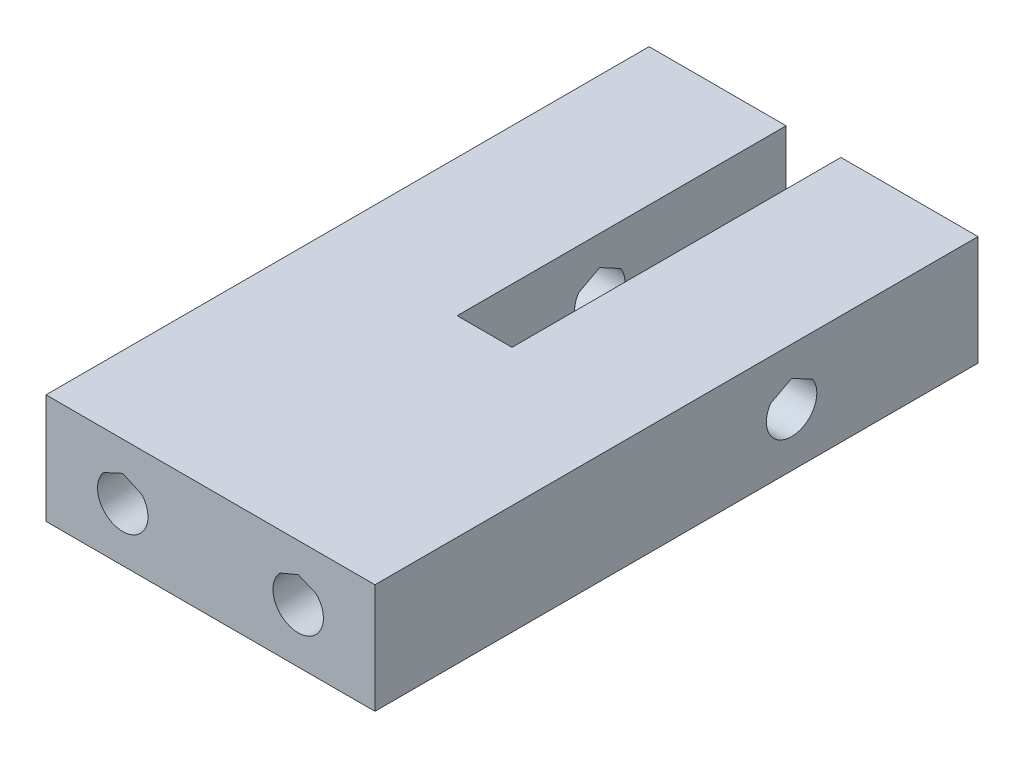
from build123d import *

# Parameters (mm, degrees)
SKETCH1_W           = 30
SKETCH1_H           = 55
BOSS_EXTRUDE1_DEPTH = 10
CUT_EXTRUDE1_DEPTH  = 58.879184514
CUT_EXTRUDE3_DEPTH  = 42.907636536
SKETCH9_W           = 5
SKETCH9_H           = 30
CUT_EXTRUDE4_DEPTH  = 10


with BuildPart() as part:
    # Sketch1 → Boss-Extrude1 (new body)
    with BuildSketch(Plane(origin=(0, 0, 0), x_dir=(1, 0, 0), z_dir=(0, 1, 0))):
        Rectangle(SKETCH1_W, SKETCH1_H)
    extrude(amount=BOSS_EXTRUDE1_DEPTH)

    # Sketch6 → Cut-Extrude1 (cut, through all)
    with BuildSketch(Plane(origin=(0, 0, -27.5), x_dir=(-1, 0, 0), z_dir=(0, 0, -1))):
        with BuildLine():
            Line((-8, 7.3), (-9.647377045, 6.605038589))
            ThreePointArc((-9.647377045, 6.605038589), (-8, 2.7), (-6.352622955, 6.605038589))
            Line((-6.352622955, 6.605038589), (-8, 7.3))
        make_face()
        with BuildLine():
            Line((8, 7.3), (6.243284106, 6.484570399))
            ThreePointArc((6.243284106, 6.484570399), (8, 2.7), (9.756715894, 6.484570399))
            Line((9.756715894, 6.484570399), (8, 7.3))
        make_face()
    extrude(amount=-CUT_EXTRUDE1_DEPTH, mode=Mode.SUBTRACT)

    # Sketch8 → Cut-Extrude3 (cut, through all)
    with BuildSketch(Plane(origin=(15, 0, 0), x_dir=(0, 0, -1), z_dir=(1, 0, 0))):
        with BuildLine():
            Line((10.5, 7.3), (12.417920009, 6.269481327))
            ThreePointArc((12.417920009, 6.269481327), (10.5, 2.7), (8.582079991, 6.269481327))
            Line((8.582079991, 6.269481327), (10.5, 7.3))
        make_face()
    extrude(amount=-CUT_EXTRUDE3_DEPTH, mode=Mode.SUBTRACT)

    # Sketch9 → Cut-Extrude4 (cut)
    with BuildSketch(Plane.XZ):
        with Locations((0, -12.5)):
            Rectangle(SKETCH9_W, SKETCH9_H)
    extrude(amount=-CUT_EXTRUDE4_DEPTH, mode=Mode.SUBTRACT)


solid = part.part
